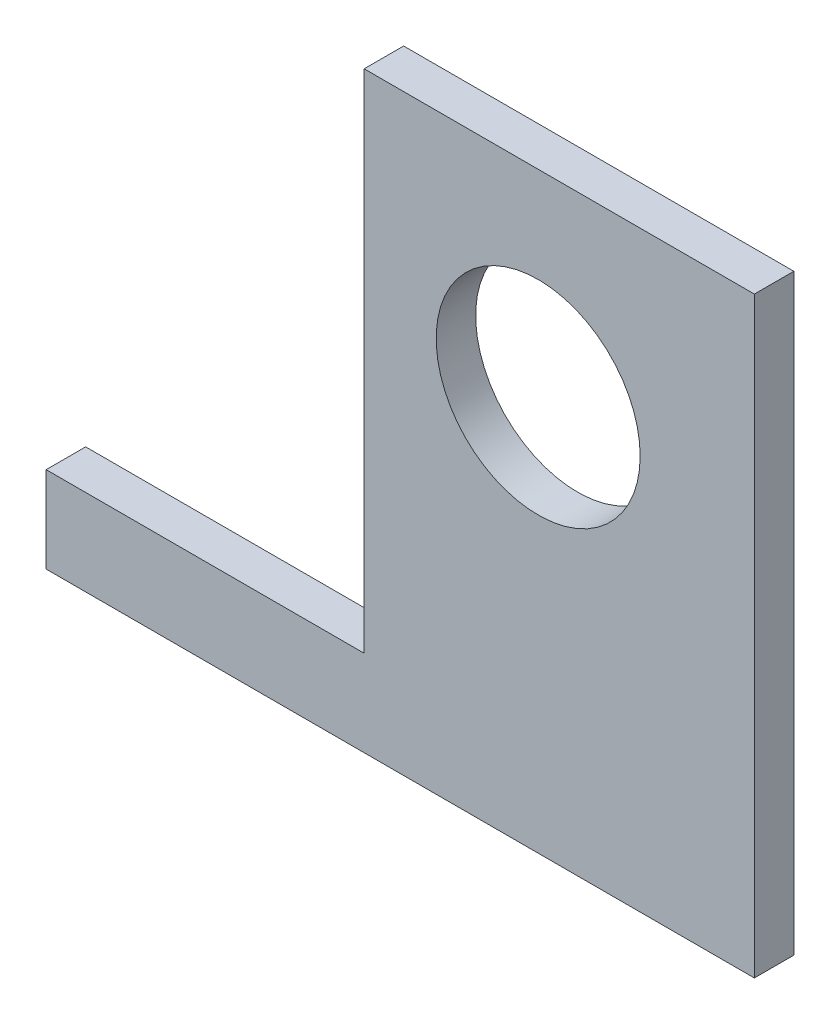
from build123d import *

# Parameters (mm, degrees)
SKETCH1_W           = 500
SKETCH1_H           = 150
BOSS_EXTRUDE1_DEPTH = 10
SKETCH2_R           = 25.831615562
CUT_EXTRUDE1_DEPTH  = 10
SKETCH3_W           = 401.190926376
SKETCH3_H           = 128.182737921
CUT_EXTRUDE2_DEPTH  = 10
SKETCH5_W           = 641.31413219
SKETCH5_H           = 43.634524158
CUT_EXTRUDE3_DEPTH  = 10


with BuildPart() as part:
    # Sketch1 → Boss-Extrude1 (new body)
    with BuildSketch(Plane.XY):
        Rectangle(SKETCH1_W, SKETCH1_H)
    extrude(amount=BOSS_EXTRUDE1_DEPTH)

    # Sketch2 → Cut-Extrude1 (cut)
    with BuildSketch(Plane.XY.offset(10)):
        with Locations((195.256623511, 25)):
            Circle(SKETCH2_R)
    extrude(amount=-CUT_EXTRUDE1_DEPTH, mode=Mode.SUBTRACT)

    # Sketch3 → Cut-Extrude2 (cut)
    with BuildSketch(Plane.XY.offset(10)):
        with Locations((-49.404536812, 10.908631039)):
            Rectangle(SKETCH3_W, SKETCH3_H)
    extrude(amount=-CUT_EXTRUDE2_DEPTH, mode=Mode.SUBTRACT)

    # Sketch5 → Cut-Extrude3 (cut)
    with BuildSketch(Plane.XY.offset(10)):
        with Locations((-250, -53.182737921)):
            Rectangle(SKETCH5_W, SKETCH5_H)
    extrude(amount=-CUT_EXTRUDE3_DEPTH, mode=Mode.SUBTRACT)


solid = part.part
